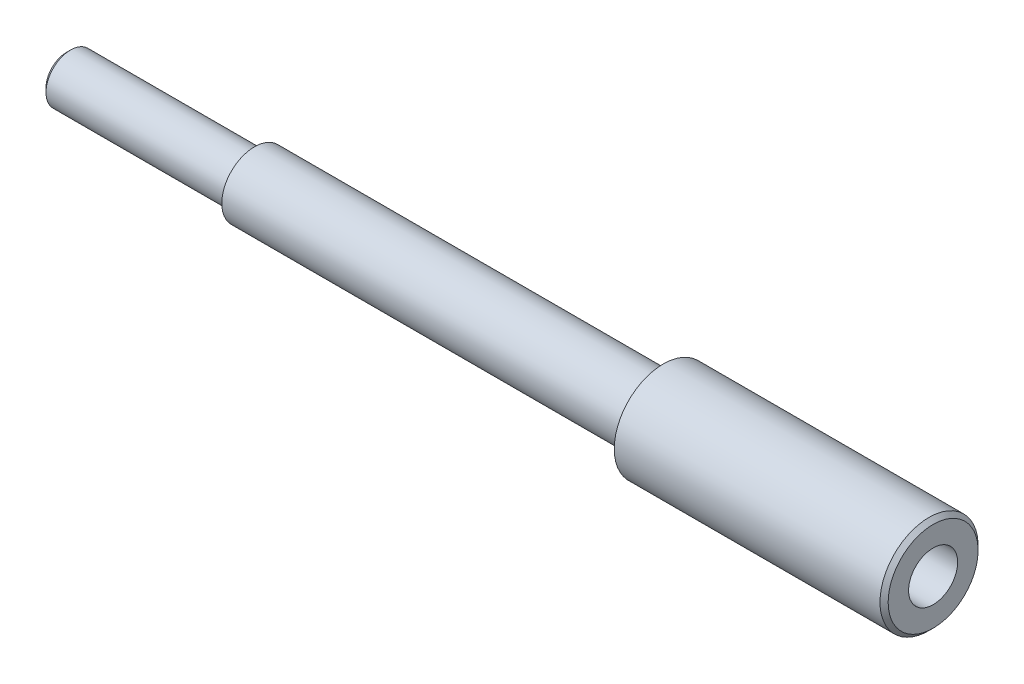
from build123d import *


with BuildPart() as part:
    # Sketch_Shaft_Profile → Shaft_Revolve_12x33_8x50_M6x23_TappedM6x14 (revolve)
    with BuildSketch(Plane.XY):
        Polygon((0, 0), (0, 2.5), (0.5, 3), (23, 3), (23, 4), (73, 4), (73, 6), (105.5, 6), (106, 5.5), (106, 3), (92, 3), (92, 0), align=None)
    revolve(axis=Axis((-5, 0, 0), (1, 0, 0)))


solid = part.part
